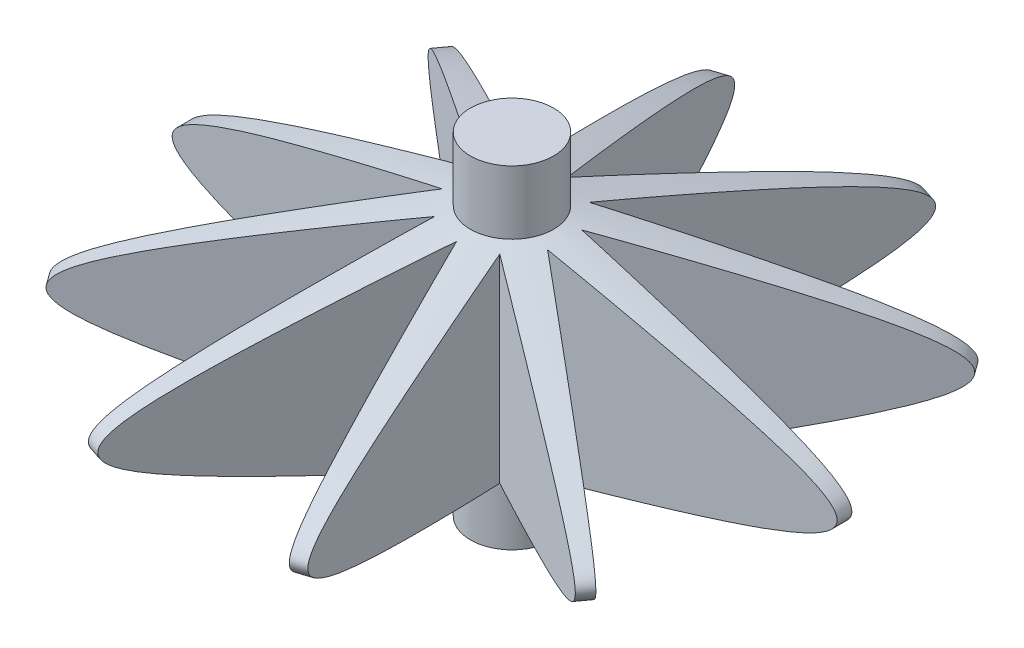
from build123d import *

# Parameters (mm, degrees)
CUT_EXTRUDE1_DEPTH = 132.982271652
CIRPATTERN2_COUNT  = 10


with BuildPart() as part:
    # Sketch2 → Revolve1 (revolve)
    with BuildSketch(Plane.XY, mode=Mode.PRIVATE) as revolve1_sk:
        with BuildLine():
            Line((0, 0), (9.525, 0))
            Line((9.525, 0), (9.525, 14.553569803))
            add(Edge.make_bspline(
                [(9.525, 61.646430197), (101.6, 38.1), (9.525, 14.553569803)],
                knots=[0, 0, 0, 1, 1, 1], degree=2, weights=[1, 2.625, 1]))
            Line((9.525, 61.646430197), (9.525, 76.2))
            Line((9.525, 76.2), (0, 76.2))
            Line((0, 76.2), (0, 67.481292958))
            Line((0, 67.481292958), (0, 16.681292958))
            Line((0, 16.681292958), (0, 0))
        make_face()
    revolve(revolve1_sk.sketch.rotate(Axis((0, 0, 0), (0, 1, 0)), 90), axis=Axis((0, 0, 0), (0, 1, 0)))

    # Sketch3 → Cut-Extrude1 (cut, through all)
    with BuildSketch(Plane(origin=(0, 0, 0), x_dir=(1, 0, 0), z_dir=(0, 1, 0))):
        Polygon((-27.734531851, -88.9), (0, -12.7), (27.734531851, -88.9), align=None)
    cut_extrude1 = extrude(amount=CUT_EXTRUDE1_DEPTH, mode=Mode.SUBTRACT)

    # CirPattern2: Cut-Extrude1 ×10 about axis
    cirpattern2_axis = Axis((0, 0, 0), (0, 1, 0))
    for i in range(1, CIRPATTERN2_COUNT):
        add(cut_extrude1.rotate(cirpattern2_axis, i * 360 / CIRPATTERN2_COUNT), mode=Mode.SUBTRACT)


solid = part.part
